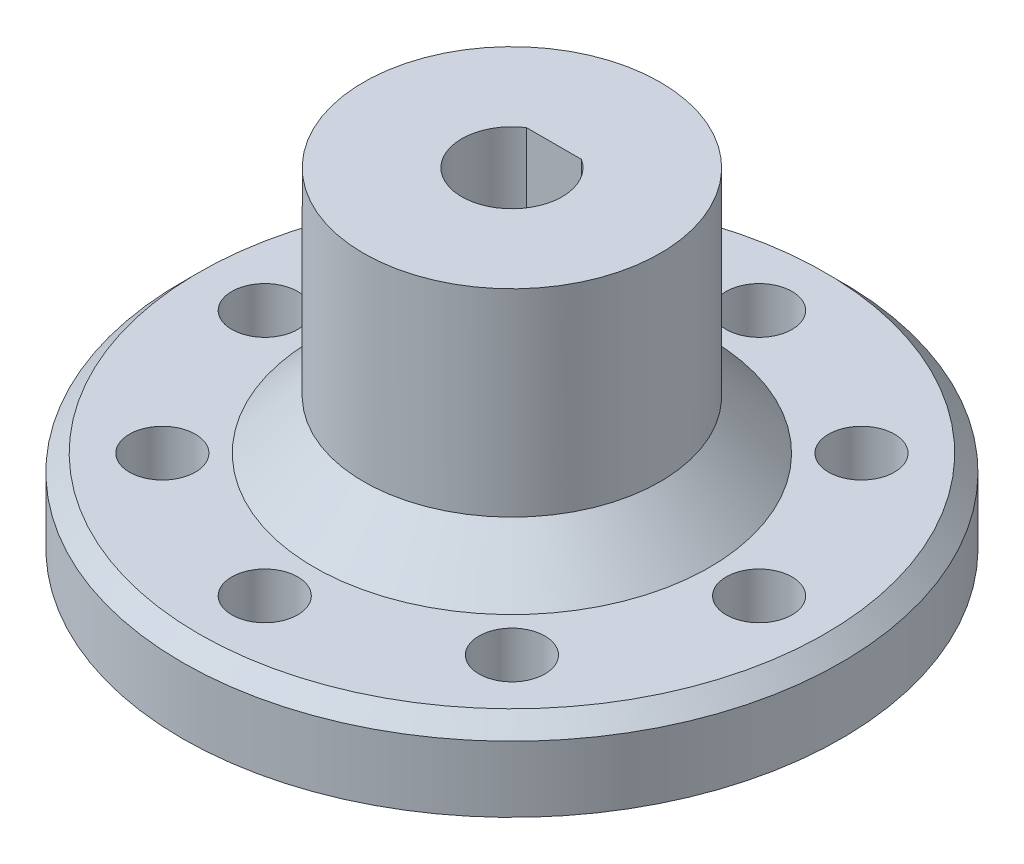
from build123d import *

# Parameters (mm, degrees)
SKETCH1_R           = 20
BOSS_EXTRUDE1_DEPTH = 5
SKETCH2_R           = 2
CUT_EXTRUDE1_DEPTH  = 29.722813233
SKETCH3_R           = 9
BOSS_EXTRUDE2_DEPTH = 15
CUT_EXTRUDE2_DEPTH  = 35.641016151
CHAMFER3_SIZE       = 3
CHAMFER4_SIZE       = 1
CUT_EXTRUDE7_DEPTH  = 3.5
CUT_EXTRUDE8_REACH  = 42.509
SKETCH10_3_R        = 1.75


with BuildPart() as part:
    # Sketch1 → Boss-Extrude1 (new body)
    with BuildSketch(Plane(origin=(0, 0, 0), x_dir=(1, 0, 0), z_dir=(0, 1, 0))):
        Circle(SKETCH1_R)
    extrude(amount=BOSS_EXTRUDE1_DEPTH)

    # Sketch2 → Cut-Extrude1 (cut, through all)
    with BuildSketch(Plane(origin=(0, 5, 0), x_dir=(1, 0, 0), z_dir=(0, 1, 0))):
        with Locations((0, 15)):
            Circle(SKETCH2_R)
        with Locations((10.606601718, 10.606601718)):
            Circle(SKETCH2_R)
        with Locations((15, 0)):
            Circle(SKETCH2_R)
        with Locations((10.606601718, -10.606601718)):
            Circle(SKETCH2_R)
        with Locations((0, -15)):
            Circle(SKETCH2_R)
        with Locations((-10.606601718, -10.606601718)):
            Circle(SKETCH2_R)
        with Locations((-15, 0)):
            Circle(SKETCH2_R)
        with Locations((-10.606601718, 10.606601718)):
            Circle(SKETCH2_R)
    extrude(amount=-CUT_EXTRUDE1_DEPTH, mode=Mode.SUBTRACT)

    # Sketch3 → Boss-Extrude2 (add)
    with BuildSketch(Plane(origin=(0, 5, 0), x_dir=(1, 0, 0), z_dir=(0, 1, 0))):
        Circle(SKETCH3_R)
    extrude(amount=BOSS_EXTRUDE2_DEPTH)

    # Sketch4 → Cut-Extrude2 (cut, through all)
    with BuildSketch(Plane(origin=(0, 20, 0), x_dir=(1, 0, 0), z_dir=(0, 1, 0))):
        with BuildLine():
            Line((1.673320053, 2.55), (-1.673320053, 2.55))
            ThreePointArc((-1.673320053, 2.55), (-1.44894338, -2.683852284), (3.05, 0))
            ThreePointArc((3.05, 0), (2.683852284, 1.44894338), (1.673320053, 2.55))
        make_face()
    extrude(amount=-CUT_EXTRUDE2_DEPTH, mode=Mode.SUBTRACT)

    # Chamfer3
    chamfer3_edges = [part.edges().sort_by_distance(p)[0] for p in [
        (-9, 5, 0),
    ]]
    chamfer(chamfer3_edges, length=CHAMFER3_SIZE)

    # Chamfer4
    chamfer4_edges = [part.edges().sort_by_distance(p)[0] for p in [
        (-20, 5, 0),
    ]]
    chamfer(chamfer4_edges, length=CHAMFER4_SIZE)

    # Sketch10 → Cut-Extrude7 (cut)
    with BuildSketch(Plane(origin=(0, 0, -9), x_dir=(-1, 0, 0), z_dir=(0, 0, -1))):
        Polygon((4.849742261, 14), (2.424871131, 18.2), (-2.424871131, 18.2), (-4.849742261, 14), (-2.424871131, 9.8), (2.424871131, 9.8), align=None)
    extrude(amount=-CUT_EXTRUDE7_DEPTH, mode=Mode.SUBTRACT)

    # Sketch10<3> → Cut-Extrude8 (cut, up to next)
    with BuildSketch(Plane(origin=(0, 0, -9), x_dir=(-1, 0, 0), z_dir=(0, 0, -1)), mode=Mode.PRIVATE) as cut_extrude8_sk1:
        with Locations((0, 14)):
            Circle(SKETCH10_3_R)
    cut_extrude8_tool1 = extrude(cut_extrude8_sk1.sketch, amount=-CUT_EXTRUDE8_REACH, mode=Mode.PRIVATE) & part.part
    add(cut_extrude8_tool1.solids().sort_by_distance((0, 14, -9))[0], mode=Mode.SUBTRACT)


solid = part.part
